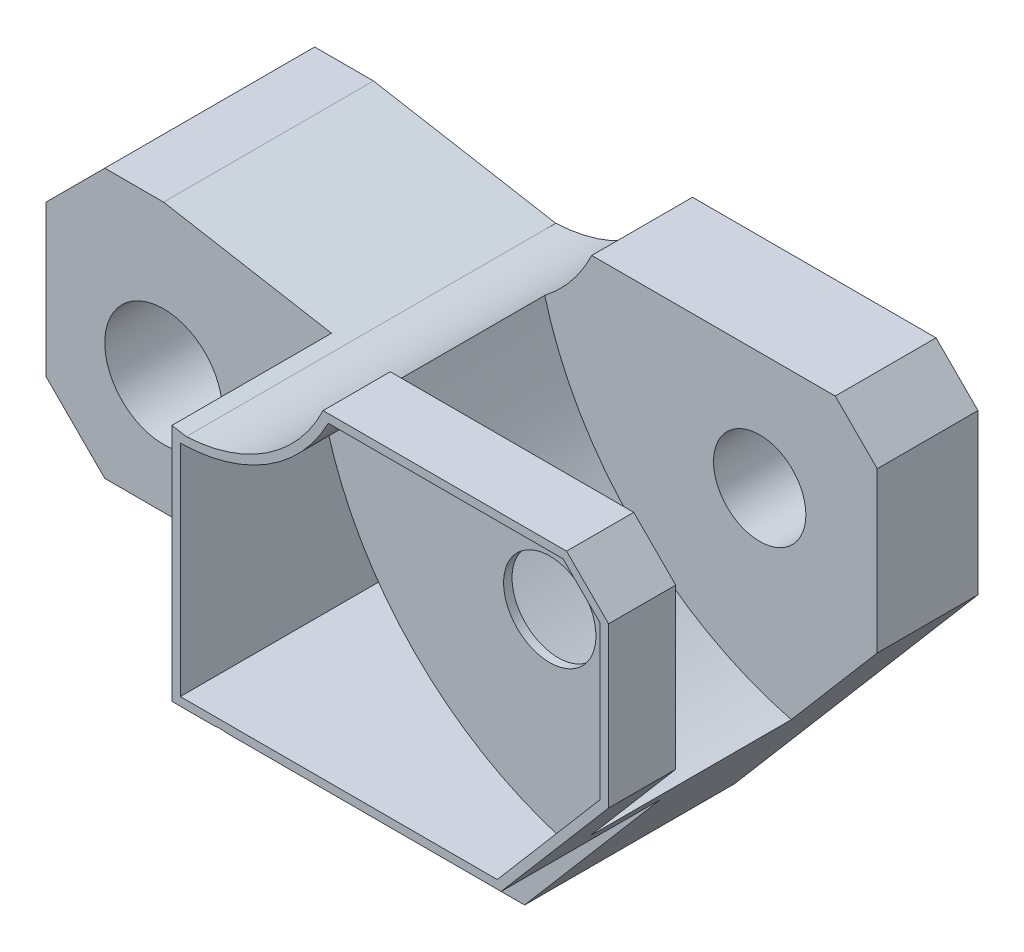
from build123d import *

# Parameters (mm, degrees)
BOSS_EXTRU_1_DEPTH       = 44
ESQUISSE2_R              = 7
ENL_V_MAT_EXTRU_1_DEPTH  = 44
ENL_V_MAT_EXTRU_2_DEPTH  = 19
ESQUISSE4_R              = 5.5
ENL_V_MAT_EXTRU_3_DEPTH  = 50
ENL_V_START              = -19
ENL_V_MAT_EXTRU_5_DEPTH  = 19
ENL_V_START_2            = -32
ENL_V_MAT_EXTRU_8_DEPTH  = 32
BOSS_EXTRU_3_START       = -8
BOSS_EXTRU_3_DEPTH       = 8
ESQUISSE15_R             = 5.5
ENL_V_MAT_EXTRU_9_DEPTH  = 44
ENL_V_MAT_EXTRU_10_DEPTH = 7
ENL_V_MAT_EXTRU_11_DEPTH = 32


with BuildPart() as part:
    # Esquisse1 → Boss.-Extru.1 (new body)
    with BuildSketch(Plane.XY):
        with BuildLine():
            Line((69.055498862, 42.585779817), (98.055498862, 42.585779817))
            Line((98.055498862, 42.585779817), (103.055498862, 37.585779817))
            Line((103.055498862, 37.585779817), (103.055498862, 18.585779817))
            Line((103.055498862, 18.585779817), (74.055498862, -15.414220183))
            Line((74.055498862, -15.414220183), (68.352478915, -15.414220183))
            ThreePointArc((68.352478915, -15.414220183), (64.19229693, -9.118662105), (61.797161375, -1.962930743))
            ThreePointArc((61.797161375, -1.962930743), (60.309086392, 2.242265049), (56.055498862, 3.585779817))
            Line((56.055498862, 3.585779817), (24.055498862, 3.585779817))
            Line((24.055498862, 3.585779817), (17.055498862, 10.585779817))
            Line((17.055498862, 10.585779817), (17.055498862, 28.585779817))
            Line((17.055498862, 28.585779817), (24.055498862, 35.585779817))
            Line((24.055498862, 35.585779817), (31.055498862, 35.585779817))
            Line((31.055498862, 35.585779817), (52.765077496, 31.757795364))
            ThreePointArc((52.765077496, 31.757795364), (62.410764196, 34.914360395), (69.055498862, 42.585779817))
        make_face()
    extrude(amount=BOSS_EXTRU_1_DEPTH)

    # Esquisse2 → Enlèv. mat.-Extru.1 (cut)
    with BuildSketch(Plane.XY.offset(44)):
        with Locations((31.055498862, 17.585779817)):
            Circle(ESQUISSE2_R)
    extrude(amount=-ENL_V_MAT_EXTRU_1_DEPTH, mode=Mode.SUBTRACT)

    # Esquisse3 → Enlèv. mat.-Extru.2 (cut)
    with BuildSketch(Plane.XY.offset(44)):
        Polygon((17.055498862, 28.585779817), (17.055498862, 10.585779817), (24.055498862, 3.585779817), (51.055498862, 3.585779817), (51.055498862, 32.059240202), (31.055498862, 35.585779817), (24.055498862, 35.585779817), align=None)
    extrude(amount=-ENL_V_MAT_EXTRU_2_DEPTH, mode=Mode.SUBTRACT)

    # Esquisse4 → Enlèv. mat.-Extru.3 (cut)
    with BuildSketch(Plane.XY.offset(44)):
        with Locations((89.055498862, 28.585779817)):
            Circle(ESQUISSE4_R)
    extrude(amount=-ENL_V_MAT_EXTRU_3_DEPTH, mode=Mode.SUBTRACT)

    # Esquisse10 → Enlèv. mat.-Extru.5 (cut)
    with BuildSketch(Plane.XY.offset(44).offset(ENL_V_START)):
        with BuildLine():
            Line((56.055498862, 3.585779817), (90.261381215, 3.585779817))
            Line((90.261381215, 3.585779817), (74.055498862, -15.414220183))
            Line((74.055498862, -15.414220183), (68.352478915, -15.414220183))
            ThreePointArc((68.352478915, -15.414220183), (64.19229693, -9.118662105), (61.797161375, -1.962930743))
            ThreePointArc((61.797161375, -1.962930743), (60.047831429, 1.971925154), (56.055498862, 3.585779817))
        make_face()
    extrude(amount=ENL_V_MAT_EXTRU_5_DEPTH, mode=Mode.SUBTRACT)

    # Esquisse13 → Enlèv. mat.-Extru.8 (cut)
    with BuildSketch(Plane.XY.offset(44).offset(ENL_V_START_2)):
        with BuildLine():
            Line((69.055498862, 42.585779817), (98.055498862, 42.585779817))
            Line((98.055498862, 42.585779817), (103.055498862, 37.585779817))
            Line((103.055498862, 37.585779817), (103.055498862, 18.585779817))
            Line((103.055498862, 18.585779817), (92.820204745, 6.585779817))
            ThreePointArc((92.820204745, 6.585779817), (74.207332122, 17.1537679), (63.456424114, 35.661587231))
            ThreePointArc((63.456424114, 35.661587231), (66.667333439, 38.791037909), (69.055498862, 42.585779817))
        make_face()
    extrude(amount=ENL_V_MAT_EXTRU_8_DEPTH, mode=Mode.SUBTRACT)

    # Esquisse14 → Boss.-Extru.3 (add)
    with BuildSketch(Plane.XY.offset(44).offset(BOSS_EXTRU_3_START)):
        with BuildLine():
            Line((92.820204745, 6.585779817), (103.055498862, 18.585779817))
            Line((103.055498862, 18.585779817), (103.055498862, 37.585779817))
            Line((103.055498862, 37.585779817), (98.055498862, 42.585779817))
            Line((98.055498862, 42.585779817), (69.055498862, 42.585779817))
            ThreePointArc((69.055498862, 42.585779817), (66.667333439, 38.791037909), (63.456424114, 35.661587231))
            ThreePointArc((63.456424114, 35.661587231), (74.207332122, 17.1537679), (92.820204745, 6.585779817))
        make_face()
    extrude(amount=BOSS_EXTRU_3_DEPTH)

    # Esquisse15 → Enlèv. mat.-Extru.9 (cut)
    with BuildSketch(Plane.XY.offset(44)):
        with Locations((89.055498862, 28.585779817)):
            Circle(ESQUISSE15_R)
    extrude(amount=-ENL_V_MAT_EXTRU_9_DEPTH, mode=Mode.SUBTRACT)

    # Esquisse16 → Enlèv. mat.-Extru.10 (cut)
    with BuildSketch(Plane.XY.offset(44)):
        with BuildLine():
            Line((52.055498862, 30.738438438), (52.055498862, 5.694877453))
            Line((52.055498862, 5.694877453), (52.055498862, 4.585779817))
            Line((52.055498862, 4.585779817), (89.799975158, 4.585779817))
            Line((89.799975158, 4.585779817), (99.846475633, 16.364435546))
            Line((99.846475633, 16.364435546), (102.055498862, 18.954324849))
            Line((102.055498862, 18.954324849), (102.055498862, 19.210406558))
            Line((102.055498862, 19.210406558), (102.055498862, 37.171566254))
            Line((102.055498862, 37.171566254), (97.6412853, 41.585779817))
            Line((97.6412853, 41.585779817), (69.792651449, 41.585779817))
            Line((69.792651449, 41.585779817), (69.676351802, 41.585779817))
            ThreePointArc((69.676351802, 41.585779817), (62.377758595, 33.70622702), (52.055498862, 30.738438438))
        make_face()
    extrude(amount=-ENL_V_MAT_EXTRU_10_DEPTH, mode=Mode.SUBTRACT)

    # Esquisse17 → Enlèv. mat.-Extru.11 (cut)
    with BuildSketch(Plane.XY.offset(37)):
        with BuildLine():
            ThreePointArc((62.594221181, 33.84139262), (57.542094296, 31.552111629), (52.055498862, 30.738438438))
            Line((52.055498862, 30.738438438), (52.055498862, 4.585779817))
            Line((52.055498862, 4.585779817), (89.799975158, 4.585779817))
            Line((89.799975158, 4.585779817), (90.652916335, 5.585779817))
            ThreePointArc((90.652916335, 5.585779817), (72.962922789, 16.078451846), (62.594221181, 33.84139262))
        make_face()
    extrude(amount=-ENL_V_MAT_EXTRU_11_DEPTH, mode=Mode.SUBTRACT)


solid = part.part
